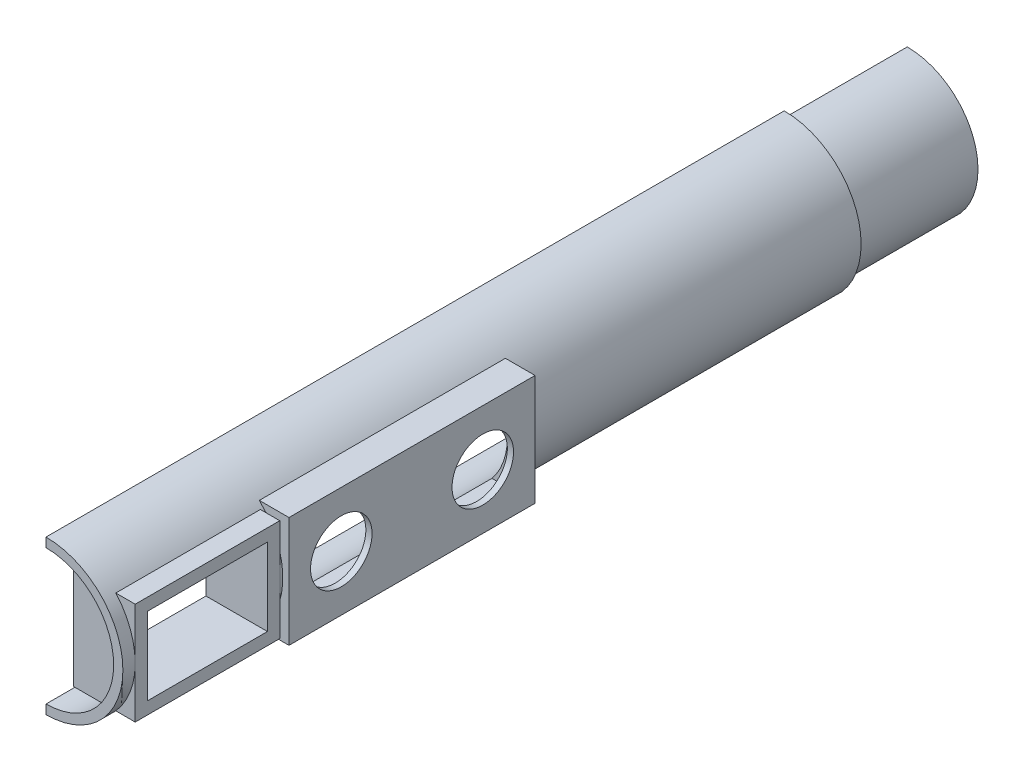
from build123d import *

# Parameters (mm, degrees)
SKETCH1_W                = 15.3
SKETCH1_H                = 180
SKETCH1_W_2              = 12.3
SKETCH1_H_2              = 20
BOSS_EXTRUDE1_DEPTH      = 120
BOSS_EXTRUDE1_DEPTH_BACK = 9
SKETCH4_R                = 12.5
BOSS_EXTRUDE2_START      = -25
SKETCH6_W                = 40
SKETCH6_H                = 18
SKETCH6_W_2              = 36
SKETCH6_H_2              = 14
BOSS_EXTRUDE2_DEPTH      = 10
SKETCH2_R                = 10.8
CUT_EXTRUDE1_DEPTH       = 199
SKETCH5_R                = 11
CUT_EXTRUDE2_DEPTH       = 133
SKETCH7_W                = 36
SKETCH7_H                = 14
CUT_EXTRUDE3_DEPTH       = 15
BOSS_EXTRUDE3_START      = -11
SKETCH8_W                = 5.5
SKETCH8_H                = 22
BOSS_EXTRUDE3_DEPTH      = 6
SKETCH10_W               = 23.5
SKETCH10_H               = 16.6
SKETCH10_W_2             = 19.5
SKETCH10_H_2             = 12.6
BOSS_EXTRUDE5_DEPTH      = 10
SKETCH11_W               = 19.5
SKETCH11_H               = 12.6
CUT_EXTRUDE4_DEPTH       = 12
SKETCH13_W               = 40
SKETCH13_H               = 18
SKETCH13_R               = 5
BOSS_EXTRUDE6_DEPTH      = 1
CUT_EXTRUDE7_DEPTH       = 106
CUT_EXTRUDE7_DEPTH_BACK  = 39
SKETCH15_W               = 30.6
SKETCH15_H               = 203.669908639
SKETCH16_R               = 12.5
BOSS_EXTRUDE7_DEPTH      = 2
SKETCH17_R               = 11.5
SKETCH17_R_2             = 10
BOSS_EXTRUDE8_DEPTH      = 20
CUT_EXTRUDE8_START       = -2
SKETCH18_R               = 10
CUT_EXTRUDE8_DEPTH       = 2
SKETCH9_R                = 1.75
BOSS_EXTRUDE4_DEPTH      = 2
CUT_EXTRUDE10_DEPTH      = 182


with BuildPart() as part:
    # Sketch1 → Revolve1 (revolve)
    with BuildSketch(Plane.XY, mode=Mode.PRIVATE) as revolve1_sk:
        with Locations((-7.65, 90)):
            Rectangle(SKETCH1_W, SKETCH1_H)
        with Locations((-6.15, -10)):
            Rectangle(SKETCH1_W_2, SKETCH1_H_2)
    revolve(revolve1_sk.sketch.rotate(Axis((0, 259.808396335, 0), (0, -1, 0)), 270), axis=Axis((0, 259.808396335, 0), (0, -1, 0)))

    # Sketch4 → Boss-Extrude1 (add, two sides: drawn at the far end of the back side and taken through both)
    with BuildSketch(Plane.XY.offset(15.3).offset(-BOSS_EXTRUDE1_DEPTH_BACK)):
        with Locations((0, 152.071263422)):
            Circle(SKETCH4_R)
    extrude(amount=BOSS_EXTRUDE1_DEPTH + BOSS_EXTRUDE1_DEPTH_BACK)

    # Sketch6 → Boss-Extrude2 (add)
    with BuildSketch(Plane.ZY.offset(12.5).offset(BOSS_EXTRUDE2_START)):
        with Locations((89.3, 152.071263422)):
            Rectangle(SKETCH6_W, SKETCH6_H)
        with Locations((89.3, 152.071263422)):
            Rectangle(SKETCH6_W_2, SKETCH6_H_2, mode=Mode.SUBTRACT)
    extrude(amount=BOSS_EXTRUDE2_DEPTH)

    # Sketch2 → Cut-Extrude1 (cut)
    with BuildSketch(Plane.XZ.offset(20)):
        with Locations(Location((0, 0, 0), (0, 0, 270))):
            Circle(SKETCH2_R)
    extrude(amount=-CUT_EXTRUDE1_DEPTH, mode=Mode.SUBTRACT)

    # Sketch5 → Cut-Extrude2 (cut)
    with BuildSketch(Plane.XY.offset(135.3)):
        with Locations((0, 152.071263422)):
            Circle(SKETCH5_R)
    extrude(amount=-CUT_EXTRUDE2_DEPTH, mode=Mode.SUBTRACT)

    # Sketch7 → Cut-Extrude3 (cut)
    with BuildSketch(Plane(origin=(12.5, 0, 0), x_dir=(0, 0, -1), z_dir=(1, 0, 0))):
        with Locations((-89.3, 152.071263422)):
            Rectangle(SKETCH7_W, SKETCH7_H)
    extrude(amount=-CUT_EXTRUDE3_DEPTH, mode=Mode.SUBTRACT)

    # Sketch8 → Boss-Extrude3 (add)
    with BuildSketch(Plane.XY.offset(71.3).offset(BOSS_EXTRUDE3_START)):
        with Locations((2.75, 152.071263422)):
            Rectangle(SKETCH8_W, SKETCH8_H)
        with BuildLine():
            ThreePointArc((8.485281374, 159.071263422), (7.105810702, 160.468135117), (5.5, 161.597542863))
            Line((5.5, 161.597542863), (5.5, 142.54498398))
            ThreePointArc((5.5, 142.54498398), (7.105810702, 143.674391726), (8.485281374, 145.071263422))
            ThreePointArc((8.485281374, 145.071263422), (11, 152.071263422), (8.485281374, 159.071263422))
        make_face()
    extrude(amount=-BOSS_EXTRUDE3_DEPTH)

    # Sketch10 → Boss-Extrude5 (add)
    with BuildSketch(Plane(origin=(12.5, 0, 0), x_dir=(0, 0, -1), z_dir=(1, 0, 0))):
        with Locations((-121.55, 152.071263422)):
            Rectangle(SKETCH10_W, SKETCH10_H)
        with Locations((-121.55, 152.071263422)):
            Rectangle(SKETCH10_W_2, SKETCH10_H_2, mode=Mode.SUBTRACT)
    extrude(amount=-BOSS_EXTRUDE5_DEPTH)

    # Sketch11 → Cut-Extrude4 (cut)
    with BuildSketch(Plane(origin=(12.5, 0, 0), x_dir=(0, 0, -1), z_dir=(1, 0, 0))):
        with Locations((-121.55, 152.071263422)):
            Rectangle(SKETCH11_W, SKETCH11_H)
    extrude(amount=-CUT_EXTRUDE4_DEPTH, mode=Mode.SUBTRACT)

    # Sketch13 → Boss-Extrude6 (add)
    with BuildSketch(Plane(origin=(12.5, 0, 0), x_dir=(0, 0, -1), z_dir=(1, 0, 0))):
        with Locations((-89.3, 152.071263422)):
            Rectangle(SKETCH13_W, SKETCH13_H)
        with Locations((-100.8, 152.071263422)):
            Circle(SKETCH13_R, mode=Mode.SUBTRACT)
        with Locations((-77.8, 152.071263422)):
            Circle(SKETCH13_R, mode=Mode.SUBTRACT)
    extrude(amount=BOSS_EXTRUDE6_DEPTH)

    # Sketch15 → Cut-Extrude7 (cut, two sides: drawn at the far end of the back side and taken through both)
    with BuildSketch(Plane(origin=(0, 0, 0), x_dir=(0, 0, -1), z_dir=(1, 0, 0)).offset(-CUT_EXTRUDE7_DEPTH_BACK)):
        with Locations((0, 78.165045681)):
            Rectangle(SKETCH15_W, SKETCH15_H)
    extrude(amount=CUT_EXTRUDE7_DEPTH + CUT_EXTRUDE7_DEPTH_BACK, mode=Mode.SUBTRACT)

    # Sketch16 → Boss-Extrude7 (add)
    with BuildSketch(Plane(origin=(0, 0, 15.3), x_dir=(-1, 0, 0), z_dir=(0, 0, -1))):
        with Locations(Location((0, 152.071263422, 0), (0, 0, 180))):
            Circle(SKETCH16_R)
    extrude(amount=-BOSS_EXTRUDE7_DEPTH)

    # Sketch17 → Boss-Extrude8 (add)
    with BuildSketch(Plane(origin=(0, 0, 15.3), x_dir=(-1, 0, 0), z_dir=(0, 0, -1))):
        with Locations((0, 152.071263422)):
            Circle(SKETCH17_R)
        with Locations((0, 152.071263422)):
            Circle(SKETCH17_R_2, mode=Mode.SUBTRACT)
    extrude(amount=BOSS_EXTRUDE8_DEPTH)

    # Sketch18 → Cut-Extrude8 (cut)
    with BuildSketch(Plane(origin=(0, 0, 15.3), x_dir=(-1, 0, 0), z_dir=(0, 0, -1)).offset(CUT_EXTRUDE8_START)):
        with Locations((0, 152.071263422)):
            Circle(SKETCH18_R)
    extrude(amount=CUT_EXTRUDE8_DEPTH, mode=Mode.SUBTRACT)

    # Sketch9 → Boss-Extrude4 (add)
    with BuildSketch(Plane.ZY):
        with Locations((57.05, 159.671263422)):
            Circle(SKETCH9_R)
        with Locations(Location((57.05, 144.471263422, 0), (0, 0, 180))):
            Circle(SKETCH9_R)
    extrude(amount=BOSS_EXTRUDE4_DEPTH)

    # Sketch19 → Cut-Extrude10 (cut)
    with BuildSketch(Plane.XY.offset(135.3)):
        with BuildLine():
            ThreePointArc((0, 141.071263422), (-11, 152.071263422), (0, 163.071263422))
            Line((0, 163.071263422), (0, 164.571263422))
            ThreePointArc((0, 164.571263422), (-12.5, 152.071263422), (0, 139.571263422))
            Line((0, 139.571263422), (0, 141.071263422))
        make_face()
        with BuildLine():
            Line((-2.177257281, 161.7010227), (0, 161.7010227))
            Line((0, 161.7010227), (0, 163.071263422))
            ThreePointArc((0, 163.071263422), (-11, 152.071263422), (0, 141.071263422))
            Line((0, 141.071263422), (0, 142.542341384))
            Line((0, 142.542341384), (-2.177257281, 142.542341384))
            Line((-2.177257281, 142.542341384), (-2.177257281, 143.338591967))
            ThreePointArc((-2.177257281, 143.338591967), (-9, 152.071263422), (-2.177257281, 160.803934876))
            Line((-2.177257281, 160.803934876), (-2.177257281, 161.7010227))
        make_face()
        with BuildLine():
            Line((-2.177257281, 143.338591967), (-2.177257281, 160.803934876))
            ThreePointArc((-2.177257281, 160.803934876), (-9, 152.071263422), (-2.177257281, 143.338591967))
        make_face()
    extrude(amount=-CUT_EXTRUDE10_DEPTH, mode=Mode.SUBTRACT)


solid = part.part
